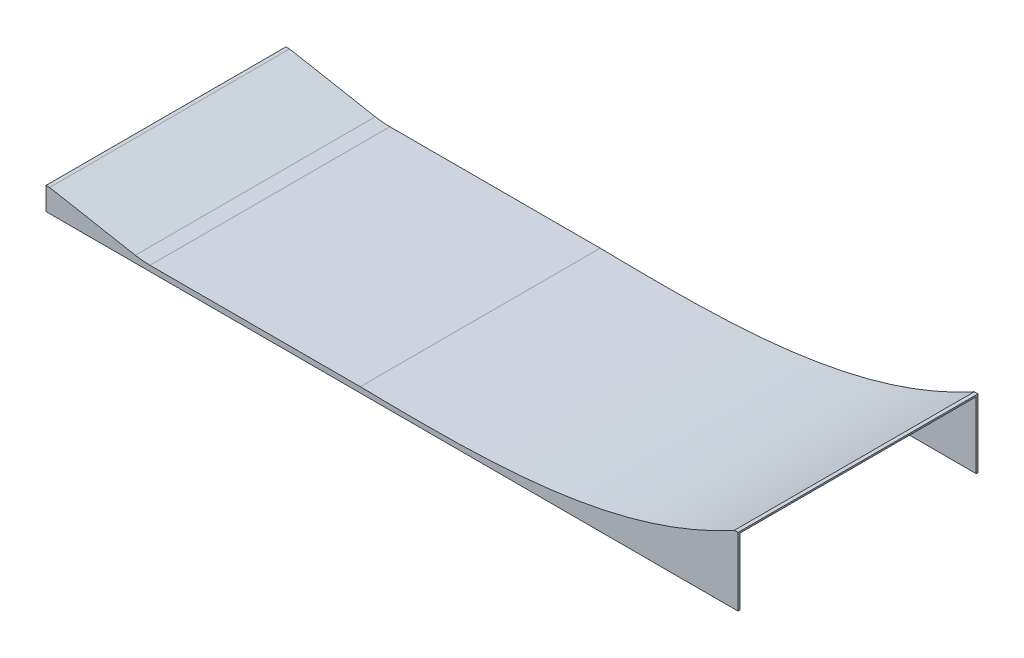
from build123d import *

# Parameters (mm, degrees)
BOSS_EXTRUDE4_DEPTH = 655.98
BOSS_EXTRUDE5_DEPTH = 5
BOSS_EXTRUDE6_START = -5
BOSS_EXTRUDE6_DEPTH = 5


with BuildPart() as part:
    # Sketch1 → Boss-Extrude4 (new body)
    with BuildSketch(Plane.XY):
        with BuildLine():
            Line((20.215160167, 0), (595.62, 0))
            add(Edge.make_bspline(
                [(595.62, 0), (948.042476236, -6.051882856), (1296.653371581, -5.972838331), (1620.872435085, 172.120900396)],
                knots=[0, 0, 0, 0, 1, 1, 1, 1], degree=3))
            Line((1620.872435085, 172.120900396), (1628.465194744, 172.120900396))
            Line((1628.465194744, 172.120900396), (1628.465194744, 176.503273491))
            Line((1628.465194744, 176.503273491), (1618.465194744, 176.503273491))
            add(Edge.make_bspline(
                [(1618.465194744, 176.503273491), (1613.433293265, 173.739246793), (1603.310973661, 168.27213908), (1583.068459987, 157.705877045), (1557.661810606, 145.118479278), (1527.045508598, 130.993416544), (1486.044926145, 113.417757786), (1434.472575503, 93.730840492), (1372.095757982, 73.506599819), (1309.256230219, 56.43208351), (1224.889687227, 37.532057264), (1118.412881741, 20.531069335), (989.242237579, 8.729922064), (880.632350211, 4.395386996), (793.286547168, 3.225460462), (727.573912047, 3.246014314), (661.707478966, 3.913095201), (617.666314008, 4.622152595), (595.662927432, 5)],
                knots=[-4.0596e-05, -4.0596e-05, -4.0596e-05, -4.0596e-05, 0.015585038, 0.031210672, 0.062461941, 0.09371321, 0.124964478, 0.187467016, 0.249969553, 0.31247209, 0.374974627, 0.499979702, 0.624984776, 0.749989851, 0.812492388, 0.874994925, 0.937497463, 1, 1, 1, 1], degree=3))
            Line((595.662927432, 5), (20.674595625, 5))
            ThreePointArc((20.674595625, 5), (0.544239519, 5.922915934), (-19.417219983, 8.683920336))
            Line((-19.417219983, 8.683920336), (-253.506029705, 52.069716759))
            Line((-253.506029705, 52.069716759), (-263.506029705, 52.069716759))
            Line((-263.506029705, 52.069716759), (-263.506029705, 47.153442221))
            Line((-263.506029705, 47.153442221), (-254.417207332, 47.153442221))
            Line((-254.417207332, 47.153442221), (-19.876655441, 3.683920336))
            ThreePointArc((-19.876655441, 3.683920336), (0.084804061, 0.922915934), (20.215160167, 0))
        make_face()
    extrude(amount=BOSS_EXTRUDE4_DEPTH)

    # Sketch3 → Boss-Extrude5 (add)
    with BuildSketch(Plane.XY):
        with BuildLine():
            Line((1628.465194744, -10), (-263.506029705, -10))
            Line((-263.506029705, -10), (-263.506029705, 52.069716759))
            Line((-263.506029705, 52.069716759), (-253.506029705, 52.069716759))
            Line((-253.506029705, 52.069716759), (-19.417219983, 8.683920336))
            ThreePointArc((-19.417219983, 8.683920336), (0.544239519, 5.922915934), (20.674595625, 5))
            Line((20.674595625, 5), (595.662927432, 5))
            add(Edge.make_bspline(
                [(1618.465194744, 176.503273491), (1613.433293265, 173.739246793), (1603.310973661, 168.27213908), (1583.068459987, 157.705877045), (1557.661810606, 145.118479278), (1527.045508598, 130.993416544), (1486.044926145, 113.417757786), (1434.472575503, 93.730840492), (1372.095757982, 73.506599819), (1309.256230219, 56.43208351), (1224.889687227, 37.532057264), (1118.412881741, 20.531069335), (989.242237579, 8.729922064), (880.632350211, 4.395386996), (793.286547168, 3.225460462), (727.573912047, 3.246014314), (661.707478966, 3.913095201), (617.666314008, 4.622152595), (595.662927432, 5)],
                knots=[-4.0596e-05, -4.0596e-05, -4.0596e-05, -4.0596e-05, 0.015585038, 0.031210672, 0.062461941, 0.09371321, 0.124964478, 0.187467016, 0.249969553, 0.31247209, 0.374974627, 0.499979702, 0.624984776, 0.749989851, 0.812492388, 0.874994925, 0.937497463, 1, 1, 1, 1], degree=3))
            Line((1618.465194744, 176.503273491), (1628.465194744, 176.503273491))
            Line((1628.465194744, 176.503273491), (1628.465194744, -10))
        make_face()
    extrude(amount=BOSS_EXTRUDE5_DEPTH)

    # Sketch4 → Boss-Extrude6 (add)
    with BuildSketch(Plane.XY.offset(655.98).offset(BOSS_EXTRUDE6_START)):
        with BuildLine():
            Line((1628.465194744, 176.503273491), (1628.465194744, -10))
            Line((1628.465194744, -10), (-263.506029705, -10))
            Line((-263.506029705, -10), (-263.506029705, 52.069716759))
            Line((-263.506029705, 52.069716759), (-253.506029705, 52.069716759))
            Line((-253.506029705, 52.069716759), (-19.417219983, 8.683920336))
            ThreePointArc((-19.417219983, 8.683920336), (0.544239519, 5.922915934), (20.674595625, 5))
            Line((20.674595625, 5), (595.662927432, 5))
            add(Edge.make_bspline(
                [(1618.465194744, 176.503273491), (1613.433293265, 173.739246793), (1603.310973661, 168.27213908), (1583.068459987, 157.705877045), (1557.661810606, 145.118479278), (1527.045508598, 130.993416544), (1486.044926145, 113.417757786), (1434.472575503, 93.730840492), (1372.095757982, 73.506599819), (1309.256230219, 56.43208351), (1224.889687227, 37.532057264), (1118.412881741, 20.531069335), (989.242237579, 8.729922064), (880.632350211, 4.395386996), (793.286547168, 3.225460462), (727.573912047, 3.246014314), (661.707478966, 3.913095201), (617.666314008, 4.622152595), (595.662927432, 5)],
                knots=[-4.0596e-05, -4.0596e-05, -4.0596e-05, -4.0596e-05, 0.015585038, 0.031210672, 0.062461941, 0.09371321, 0.124964478, 0.187467016, 0.249969553, 0.31247209, 0.374974627, 0.499979702, 0.624984776, 0.749989851, 0.812492388, 0.874994925, 0.937497463, 1, 1, 1, 1], degree=3))
            Line((1618.465194744, 176.503273491), (1628.465194744, 176.503273491))
        make_face()
    extrude(amount=BOSS_EXTRUDE6_DEPTH)


solid = part.part
